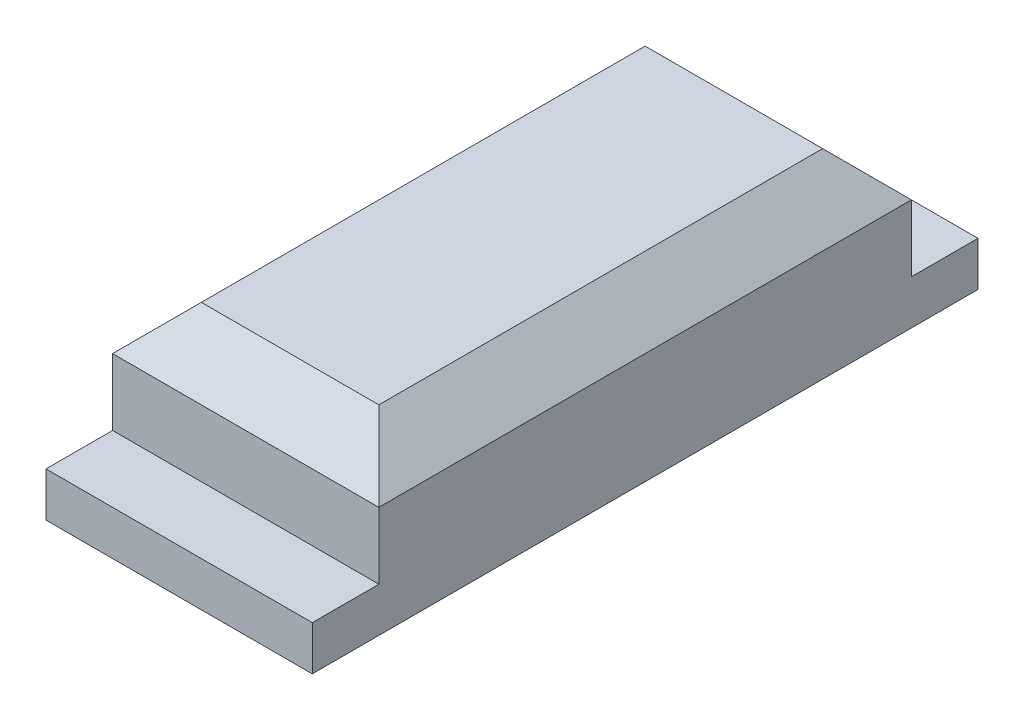
from build123d import *

# Parameters (mm, degrees)
SKETCH1_W           = 12
SKETCH1_H           = 30
BOSS_EXTRUDE1_DEPTH = 2
SKETCH2_W           = 12
SKETCH2_H           = 24
BOSS_EXTRUDE2_DEPTH = 5
CHAMFER1_SIZE       = 2


with BuildPart() as part:
    # Sketch1 → Boss-Extrude1 (new body)
    with BuildSketch(Plane(origin=(0, 0, 0), x_dir=(1, 0, 0), z_dir=(0, 1, 0))):
        with Locations((6, 15)):
            Rectangle(SKETCH1_W, SKETCH1_H)
    extrude(amount=BOSS_EXTRUDE1_DEPTH)

    # Sketch2 → Boss-Extrude2 (add)
    with BuildSketch(Plane(origin=(0, 2, 0), x_dir=(1, 0, 0), z_dir=(0, 1, 0))):
        with Locations((6, 15)):
            Rectangle(SKETCH2_W, SKETCH2_H)
    extrude(amount=BOSS_EXTRUDE2_DEPTH)

    # Chamfer1
    chamfer1_edges = [part.edges().sort_by_distance(p)[0] for p in [
        (0, 7, -15),
        (6, 7, -3),
        (12, 7, -15),
        (6, 7, -27),
    ]]
    chamfer(chamfer1_edges, length=CHAMFER1_SIZE)


solid = part.part
